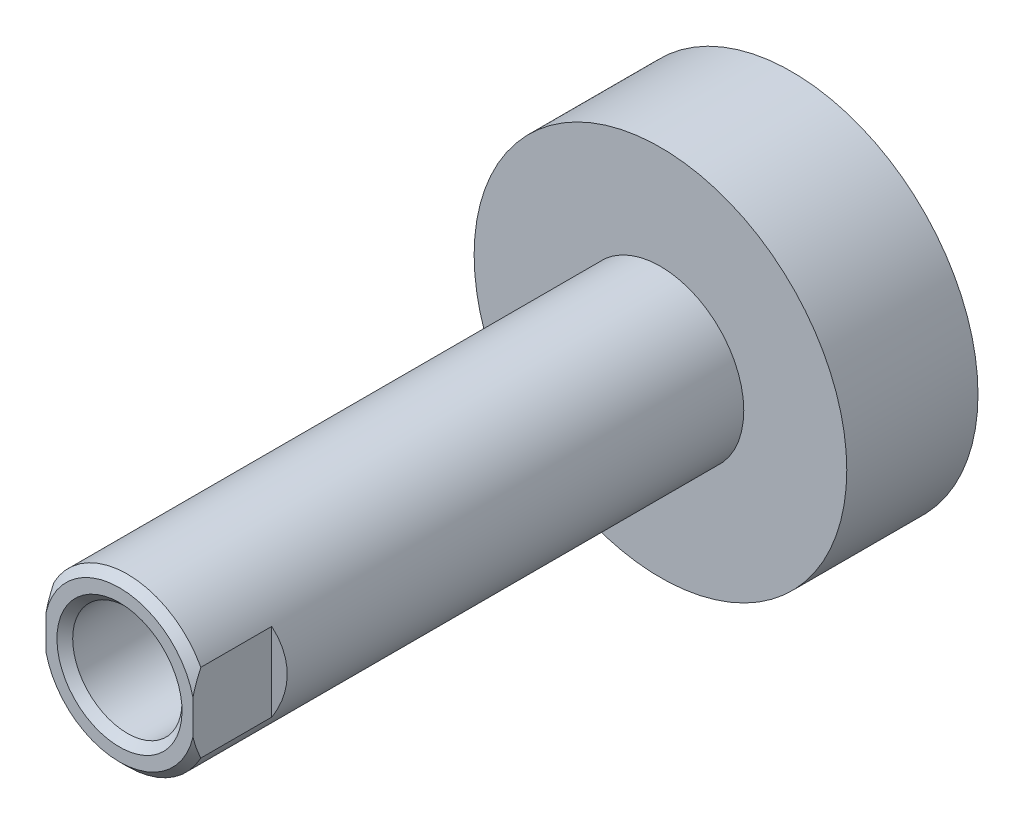
from build123d import *

# Parameters (mm, degrees)
SKETCH1_R                              = 7.1
PISTON_DEPTH                           = 5
SKETCH2_R                              = 3.175
ROD_DEPTH                              = 25.614
F_056_8_32_INTERNAL_THREAD_D           = 3.4544
F_056_8_32_INTERNAL_THREAD_DEPTH       = 14.07744
F_056_8_32_INTERNAL_THREAD_CBORE_D     = 4.1656
F_056_8_32_INTERNAL_THREAD_CBORE_DEPTH = 11.684
F_056_8_32_INTERNAL_THREAD_TIP         = 1.037806461
ROD_END_CHAMFER_SIZE                   = 0.3
WRENCH_FLATS_DEPTH                     = 28.511761049
WRENCH_FLATS_DEPTH_BACK                = 28.511761049


with BuildPart() as part:
    # Sketch1 → Piston (new body)
    with BuildSketch(Plane.XY):
        Circle(SKETCH1_R)
    extrude(amount=PISTON_DEPTH)

    # Sketch2 → Rod (add)
    with BuildSketch(Plane(origin=(0, 0, 0), x_dir=(-1, 0, 0), z_dir=(0, 0, -1))):
        with Locations(Location((0, 0, 0), (0, 0, 90))):
            Circle(SKETCH2_R)
    extrude(amount=-ROD_DEPTH)

    # 056 #8-32 Internal Thread
    with Locations(Plane(origin=(0, 0, 25.614), x_dir=(0, 1, 0), z_dir=(0, 0, 1))):
        with Locations((0, 0)):
            CounterBoreHole(F_056_8_32_INTERNAL_THREAD_D / 2, F_056_8_32_INTERNAL_THREAD_CBORE_D / 2, F_056_8_32_INTERNAL_THREAD_CBORE_DEPTH, depth=F_056_8_32_INTERNAL_THREAD_DEPTH)
            with Locations((0, 0, -(F_056_8_32_INTERNAL_THREAD_DEPTH + F_056_8_32_INTERNAL_THREAD_TIP / 2))):  # 118° drill point
                Cone(0, F_056_8_32_INTERNAL_THREAD_D / 2, F_056_8_32_INTERNAL_THREAD_TIP, mode=Mode.SUBTRACT)

    # Rod End Chamfer
    rod_end_chamfer_edges = [part.edges().sort_by_distance(p)[0] for p in [
        (0, -2.0828, 25.614),
        (0, -3.175, 25.614),
    ]]
    chamfer(rod_end_chamfer_edges, length=ROD_END_CHAMFER_SIZE)

    # Sketch11 → Wrench Flats (cut, two sides: drawn at the far end of the back side and taken through both)
    with BuildSketch(Plane(origin=(0, 0, 0), x_dir=(1, 0, 0), z_dir=(0, 1, 0)).offset(-WRENCH_FLATS_DEPTH_BACK)):
        Polygon((-2.8, -25.614), (-2.8, -22.614), (-7.8, -19.727248654), (-7.8, -25.614), align=None)
        Polygon((2.8, -25.614), (2.8, -22.614), (7.8, -19.727248654), (7.8, -25.614), align=None)
    extrude(amount=WRENCH_FLATS_DEPTH + WRENCH_FLATS_DEPTH_BACK, mode=Mode.SUBTRACT)


solid = part.part
